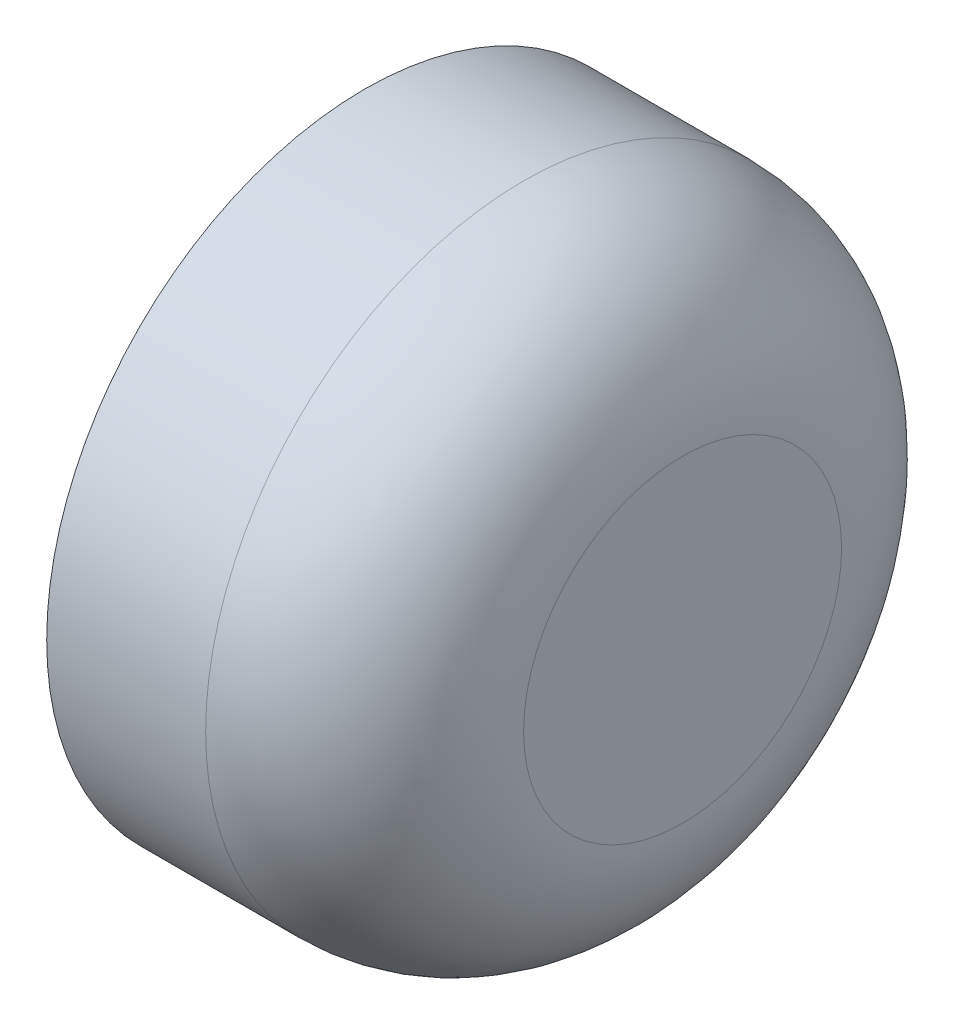
from build123d import *

# Parameters (mm, degrees)
SKETCH_1_R      = 1
EXTRUDE_1_DEPTH = 1
FILLET_1_R      = 0.5


with BuildPart() as part:
    # 草图1 → 凸台-拉伸1 (new body)
    with BuildSketch(Plane(origin=(0, 0, 0), x_dir=(0, 0, -1), z_dir=(1, 0, 0))):
        Circle(SKETCH_1_R)
    extrude(amount=EXTRUDE_1_DEPTH)

    # 圆角1
    fillet_1_edges = [part.edges().sort_by_distance(p)[0] for p in [
        (1, 0, 1),
    ]]
    fillet(fillet_1_edges, radius=FILLET_1_R)


solid = part.part
